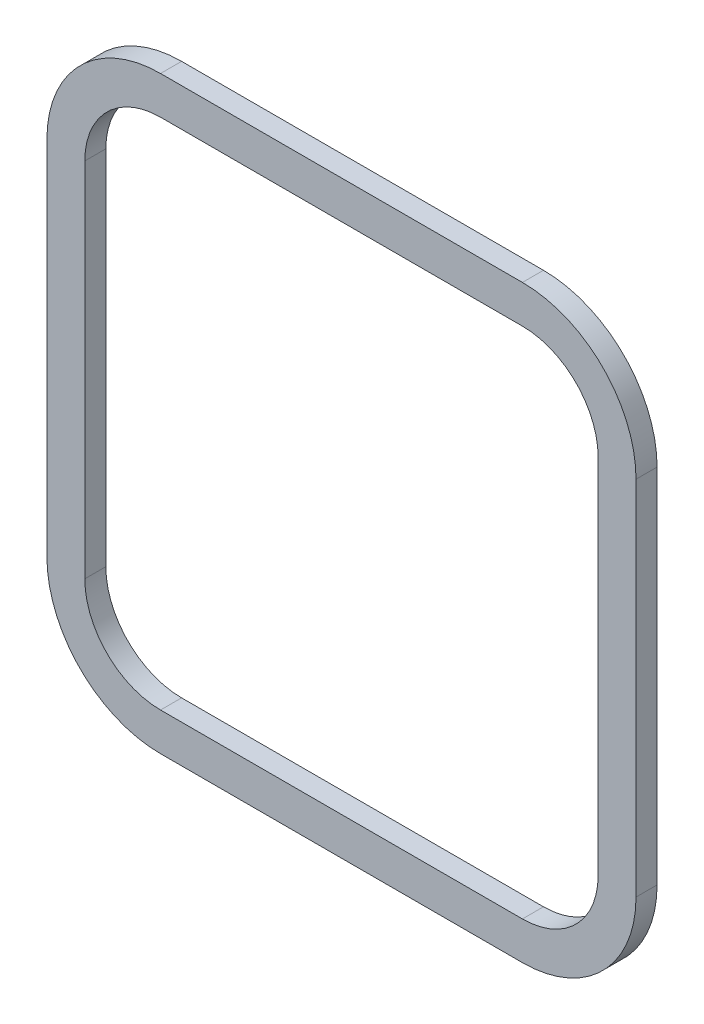
from build123d import *

# Parameters (mm, degrees)
SKETCH_1_W      = 280
SKETCH_1_H      = 280
SKETCH_1_W_2    = 244
SKETCH_1_H_2    = 244
EXTRUDE_1_DEPTH = 10
FILLET_1_R      = 36
FILLET_2_R      = 54


with BuildPart() as part:
    # 草图1 → 凸台-拉伸1 (new body)
    with BuildSketch(Plane.XY):
        Rectangle(SKETCH_1_W, SKETCH_1_H)
        Rectangle(SKETCH_1_W_2, SKETCH_1_H_2, mode=Mode.SUBTRACT)
    extrude(amount=EXTRUDE_1_DEPTH)

    # 圆角1
    fillet_1_edges = [part.edges().sort_by_distance(p)[0] for p in [
        (-122, 122, 5),
        (-122, -122, 5),
        (122, -122, 5),
        (122, 122, 5),
    ]]
    fillet(fillet_1_edges, radius=FILLET_1_R)

    # 圆角2
    fillet_2_edges = [part.edges().sort_by_distance(p)[0] for p in [
        (-140, 140, 5),
        (140, 140, 5),
        (140, -140, 5),
        (-140, -140, 5),
    ]]
    fillet(fillet_2_edges, radius=FILLET_2_R)


solid = part.part
